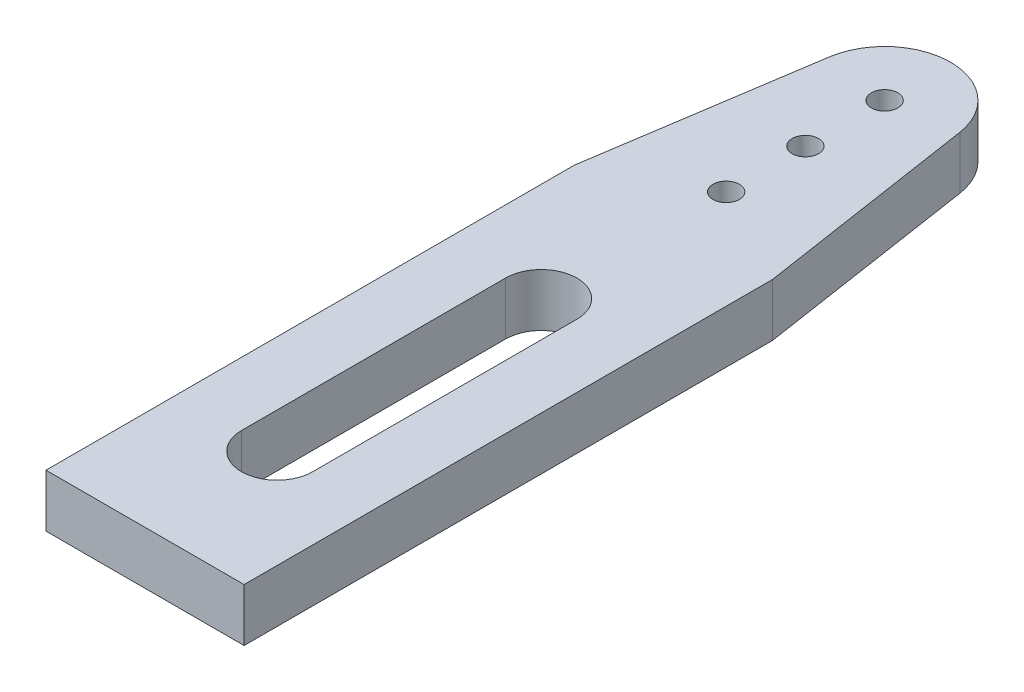
from build123d import *

# Parameters (mm, degrees)
ESQUISSE1_R        = 0.5
BOSS_EXTRU_4_DEPTH = 2


with BuildPart() as part:
    # Esquisse1 → Boss.-Extru.4 (new body)
    with BuildSketch(Plane(origin=(0, 0, 0), x_dir=(1, 0, 0), z_dir=(0, 1, 0))):
        with BuildLine():
            Line((-3.75, 15), (-2.471378864, 23.377208842))
            ThreePointArc((-2.471378864, 23.377208842), (0, 25.5), (2.471378864, 23.377208842))
            Line((2.471378864, 23.377208842), (3.75, 15))
            Line((3.75, 15), (3.75, -5))
            Line((3.75, -5), (-3.75, -5))
            Line((-3.75, -5), (-3.75, 15))
        make_face()
        with Locations(Location((0, 23, 0), (0, 0, 270))):
            Circle(ESQUISSE1_R, mode=Mode.SUBTRACT)
        with Locations(Location((0, 20, 0), (0, 0, 270))):
            Circle(ESQUISSE1_R, mode=Mode.SUBTRACT)
        with Locations(Location((0, 17, 0), (0, 0, 270))):
            Circle(ESQUISSE1_R, mode=Mode.SUBTRACT)
        with BuildLine():
            Line((-1.35, 0), (-1.35, 10))
            ThreePointArc((-1.35, 10), (0, 11.35), (1.35, 10))
            Line((1.35, 10), (1.35, 0))
            ThreePointArc((1.35, 0), (0, -1.35), (-1.35, 0))
        make_face(mode=Mode.SUBTRACT)
    extrude(amount=BOSS_EXTRU_4_DEPTH)


solid = part.part
